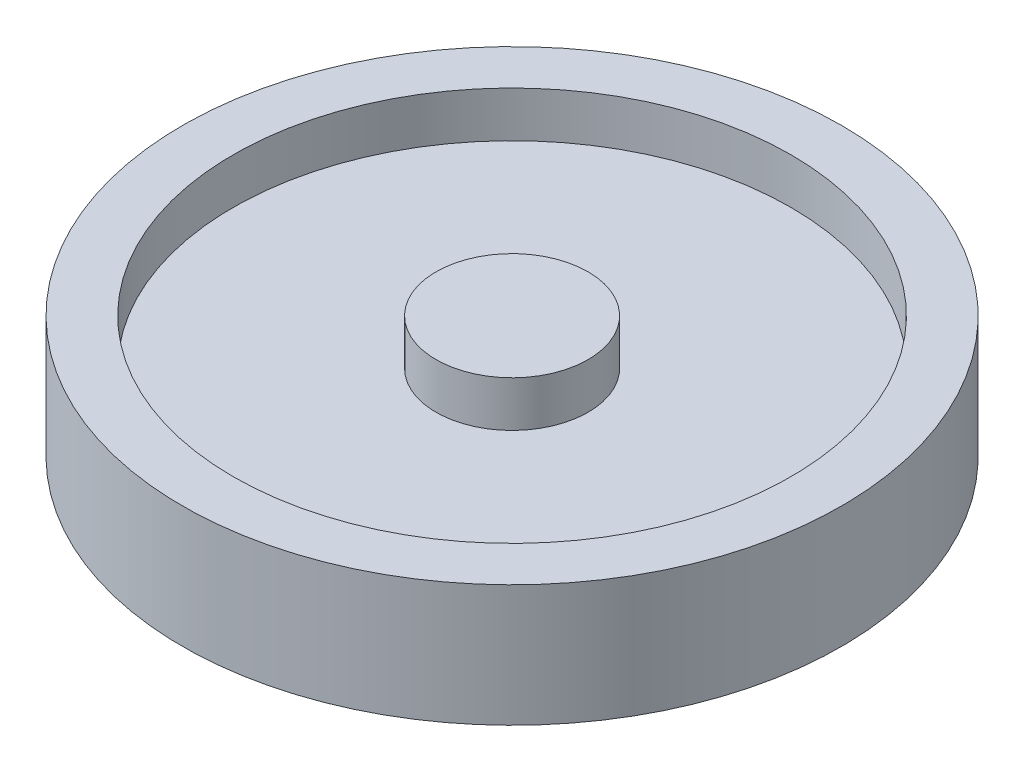
from build123d import *


with BuildPart() as part:
    # Sketch1 → Revolve1 (revolve)
    with BuildSketch(Plane.YZ, mode=Mode.PRIVATE) as revolve1_sk:
        Polygon((6, 0), (6, 7.5), (1.5, 7.5), (1.5, 27.5), (6, 27.5), (6, 32.5), (-6, 32.5), (-6, 27.5), (-1.5, 27.5), (-1.5, 7.5), (-8, 7.5), (-8, 0), align=None)
    revolve(revolve1_sk.sketch.rotate(Axis((0, 0, 0), (0, 1, 0)), 180), axis=Axis((0, 0, 0), (0, 1, 0)))


solid = part.part
